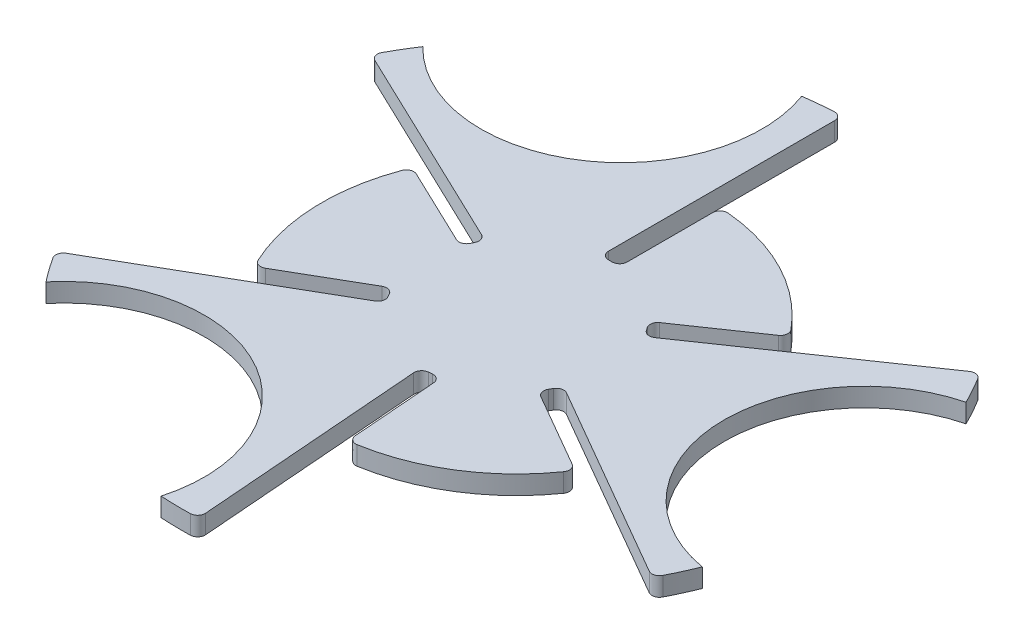
from build123d import *

# Parameters (mm, degrees)
EXTRUDE_1_DEPTH = 5
EXTRUDE_2_DEPTH = 5
FILLET_1_R      = 2


with BuildPart() as part:
    # 草圖1 → 填料-伸長1 (new body)
    with BuildSketch(Plane(origin=(0, 0, 0), x_dir=(1, 0, 0), z_dir=(0, 1, 0))):
        with BuildLine():
            Line((46.231246092, -23.80487103), (22.900635095, -10.334936491))
            Line((22.900635095, -10.334936491), (20.400635095, -14.665063509))
            Line((20.400635095, -14.665063509), (43.731246092, -28.134998049))
            ThreePointArc((43.731246092, -28.134998049), (27.733333333, -43.987068807), (6.533150216, -51.587963211))
            Line((6.533150216, -51.587963211), (4.437329437, -24.729741355))
            Line((4.437329437, -24.729741355), (-0.547516958, -25.118722602))
            Line((-0.547516958, -25.118722602), (1.54830382, -51.976944459))
            ThreePointArc((1.54830382, -51.976944459), (-24.227252358, -46.011305602), (-43.731246092, -28.134998049))
            Line((-43.731246092, -28.134998049), (-20.400635095, -14.665063509))
            Line((-20.400635095, -14.665063509), (-22.900635095, -10.334936491))
            Line((-22.900635095, -10.334936491), (-46.231246092, -23.80487103))
            ThreePointArc((-46.231246092, -23.80487103), (-51.960585691, -2.024236795), (-47.943061778, 20.136107552))
            Line((-47.943061778, 20.136107552), (-23.635248961, 8.522030659))
            Line((-23.635248961, 8.522030659), (-21.479693405, 13.033524896))
            Line((-21.479693405, 13.033524896), (-45.787506223, 24.647601788))
            ThreePointArc((-45.787506223, 24.647601788), (-27.733333333, 43.987068807), (-2.5, 51.93986908))
            Line((-2.5, 51.93986908), (-2.5, 25))
            Line((-2.5, 25), (2.5, 25))
            Line((2.5, 25), (2.5, 51.93986908))
            ThreePointArc((2.5, 51.93986908), (24.227252358, 46.011305602), (41.409911562, 31.451855659))
            Line((41.409911562, 31.451855659), (19.197919523, 16.207710695))
            Line((19.197919523, 16.207710695), (22.027210363, 12.085197706))
            Line((22.027210363, 12.085197706), (44.239202402, 27.329342671))
            ThreePointArc((44.239202402, 27.329342671), (51.960585691, 2.024236795), (46.231246092, -23.80487103))
        make_face()
    extrude(amount=-EXTRUDE_1_DEPTH)

    # 草圖2 → 填料-伸長2 (add)
    with BuildSketch(Plane(origin=(0, 0, 0), x_dir=(1, 0, 0), z_dir=(0, 1, 0))):
        with BuildLine():
            ThreePointArc((-24.227251363, -46.011306126), (-35.135166738, -38.334319588), (-43.731246092, -28.134998049))
            Line((-43.731246092, -28.134998049), (-76.229029421, -46.897602002))
            ThreePointArc((-76.229029421, -46.897602002), (-73.47242252, -51.10824913), (-70.483495632, -55.157291843))
            ThreePointArc((-70.483495632, -55.157291843), (-48.972669662, -42.404749099), (-24.227251363, -46.011306126))
        make_face()
        with BuildLine():
            ThreePointArc((1.54830382, -51.976944459), (-11.725223904, -50.660824356), (-24.227251363, -46.011306126))
            ThreePointArc((-24.227251363, -46.011306126), (-7.251240205, -64.373168028), (-5.593668694, -89.325029362))
            ThreePointArc((-5.593668694, -89.325029362), (-0.563913765, -89.498223453), (4.46762426, -89.388423934))
            Line((4.46762426, -89.388423934), (1.54830382, -51.976944459))
        make_face()
        with BuildLine():
            ThreePointArc((51.96058566, 2.024237611), (50.766077936, -11.260787317), (46.231246092, -23.80487103))
            Line((46.231246092, -23.80487103), (78.729029421, -42.567474983))
            ThreePointArc((78.729029421, -42.567474983), (80.997253349, -38.074859815), (83.009363756, -33.461851843))
            ThreePointArc((83.009363756, -33.461851843), (61.209924893, -21.209201585), (51.96058566, 2.024237611))
        make_face()
        with BuildLine():
            ThreePointArc((44.239202402, 27.329342671), (49.736172865, 15.176070265), (51.96058566, 2.024237611))
            ThreePointArc((51.96058566, 2.024237611), (59.374418845, 25.906825664), (80.154578969, 39.818255491))
            ThreePointArc((80.154578969, 39.818255491), (77.789691987, 44.26074808), (75.178833801, 48.563288071))
            Line((75.178833801, 48.563288071), (44.239202402, 27.329342671))
        make_face()
        with BuildLine():
            ThreePointArc((-27.733333643, 43.987068612), (-15.63091087, 49.595106869), (-2.5, 51.93986908))
            Line((-2.5, 51.93986908), (-2.5, 89.465076985))
            ThreePointArc((-2.5, 89.465076985), (-7.524830829, 89.183108944), (-12.525868124, 88.619143687))
            ThreePointArc((-12.525868124, 88.619143687), (-12.237255007, 63.613950927), (-27.733333643, 43.987068612))
        make_face()
        with BuildLine():
            ThreePointArc((-45.787506223, 24.647601788), (-38.010948658, 35.484754221), (-27.733333643, 43.987068612))
            ThreePointArc((-27.733333643, 43.987068612), (-52.123178355, 38.466342196), (-74.560910274, 49.506773871))
            ThreePointArc((-74.560910274, 49.506773871), (-77.225778221, 45.237475373), (-79.646458062, 40.825135863))
            Line((-79.646458062, 40.825135863), (-45.787506223, 24.647601788))
        make_face()
    extrude(amount=-EXTRUDE_2_DEPTH)

    # 圓角1
    fillet_1_edges = [part.edges().sort_by_distance(p)[0] for p in [
        (75.178833801, -2.5, -48.563288071),
        (-2.5, -2.5, -89.465076985),
        (-79.646458062, -2.5, -40.825135863),
        (4.437329437, -2.5, 24.729741355),
        (-0.547516958, -2.5, 25.118722602),
        (-20.400635095, -2.5, 14.665063509),
        (-22.900635095, -2.5, 10.334936491),
        (-46.231246092, -2.5, 23.80487103),
        (-47.943061778, -2.5, -20.136107552),
        (-23.635248961, -2.5, -8.522030659),
        (-21.479693405, -2.5, -13.033524896),
        (-2.5, -2.5, -25),
        (2.5, -2.5, -25),
        (2.5, -2.5, -51.93986908),
        (41.409911562, -2.5, -31.451855659),
        (19.197919523, -2.5, -16.207710695),
        (22.027210363, -2.5, -12.085197706),
        (22.900635095, -2.5, 10.334936491),
        (20.400635095, -2.5, 14.665063509),
        (43.731246092, -2.5, 28.134998049),
        (6.533150216, -2.5, 51.587963211),
        (-76.229029421, -2.5, 46.897602002),
        (4.46762426, -2.5, 89.388423934),
        (78.729029421, -2.5, 42.567474983),
    ]]
    fillet(fillet_1_edges, radius=FILLET_1_R)


solid = part.part
